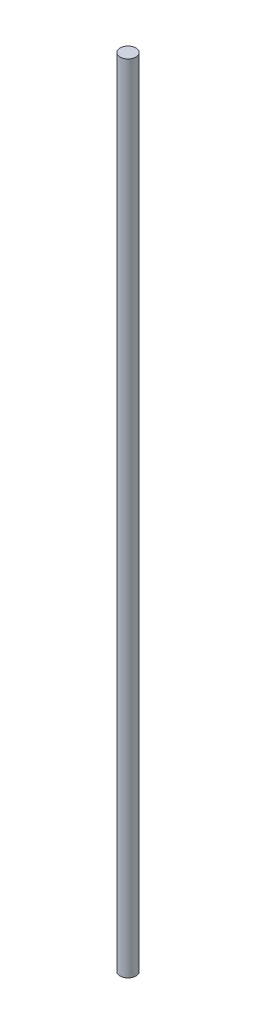
from build123d import *

# Parameters (mm, degrees)
SKETCH_1_R      = 4
EXTRUDE_1_DEPTH = 400


with BuildPart() as part:
    # 草图1 → 凸台-拉伸1 (new body)
    with BuildSketch(Plane(origin=(0, 0, 0), x_dir=(1, 0, 0), z_dir=(0, 1, 0))):
        with Locations(Location((0, 0, 0), (0, 0, 270))):
            Circle(SKETCH_1_R)
    extrude(amount=EXTRUDE_1_DEPTH)


solid = part.part
